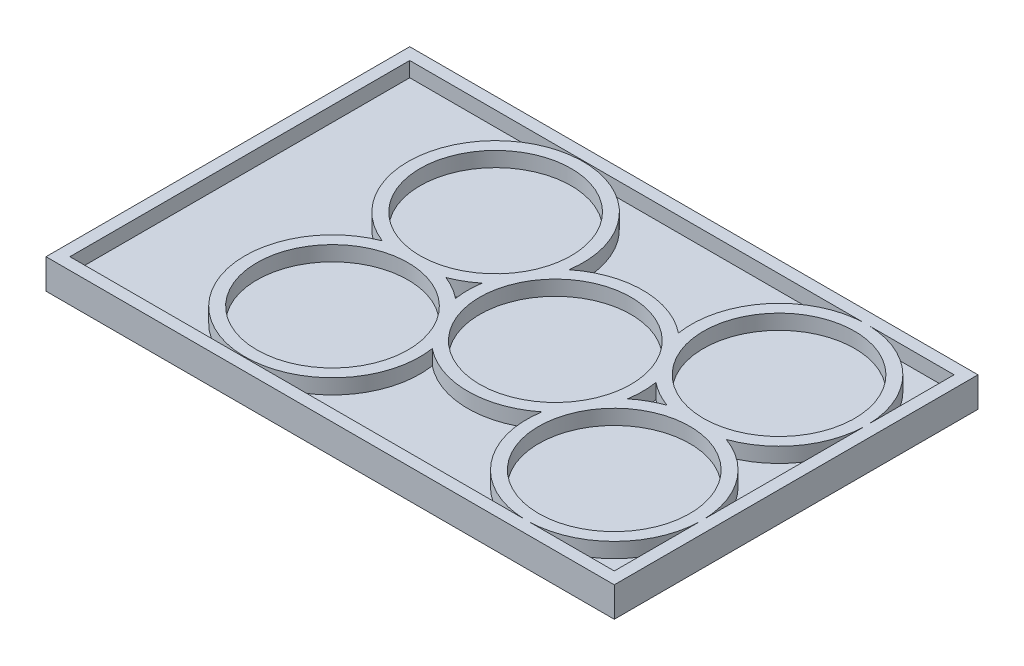
from build123d import *

# Parameters (mm, degrees)
SKETCH1_W           = 76.04
SKETCH1_H           = 48.67
BOSS_EXTRUDE1_DEPTH = 2
SKETCH2_R           = 10.115
BOSS_EXTRUDE5_DEPTH = 2
BOSS_EXTRUDE6_DEPTH = 2


with BuildPart() as part:
    # Sketch1 → Boss-Extrude1 (new body)
    with BuildSketch(Plane(origin=(0, 0, 0), x_dir=(1, 0, 0), z_dir=(0, 1, 0))):
        with Locations((-5.18381875, 15.397172461)):
            Rectangle(SKETCH1_W, SKETCH1_H)
    extrude(amount=BOSS_EXTRUDE1_DEPTH)

    # Sketch2 → Boss-Extrude5 (add)
    with BuildSketch(Plane(origin=(0, 2, 0), x_dir=(1, 0, 0), z_dir=(0, 1, 0))):
        with BuildLine():
            ThreePointArc((7.966863666, 24.51864889), (0.632329313, 27.112160631), (-6.709546926, 24.539506243))
            ThreePointArc((-6.709546926, 24.539506243), (-24.147153985, 36.457660066), (-22.544533536, 15.397172461))
            ThreePointArc((-22.544533536, 15.397172461), (-24.147153985, -5.663315144), (-6.709546926, 6.254838679))
            ThreePointArc((-6.709546926, 6.254838679), (0.632329313, 3.682184291), (7.966863666, 6.275696032))
            ThreePointArc((7.966863666, 6.275696032), (10.484956429, -3.077490534), (19.183945951, -7.337827539))
            Line((19.183945951, -7.337827539), (19.868416549, -7.337827539))
            ThreePointArc((19.868416549, -7.337827539), (27.809937192, -3.911583481), (31.23618125, 4.029937162))
            Line((31.23618125, 4.029937162), (31.23618125, 4.71440776))
            ThreePointArc((31.23618125, 4.71440776), (29.009139273, 11.250742962), (23.487317451, 15.397172461))
            ThreePointArc((23.487317451, 15.397172461), (29.009139273, 19.54360196), (31.23618125, 26.079937162))
            Line((31.23618125, 26.079937162), (31.23618125, 26.76440776))
            ThreePointArc((31.23618125, 26.76440776), (27.809937192, 34.705928403), (19.868416549, 38.132172461))
            Line((19.868416549, 38.132172461), (19.183945951, 38.132172461))
            ThreePointArc((19.183945951, 38.132172461), (10.484956429, 33.871835456), (7.966863666, 24.51864889))
        make_face()
        with Locations(Location((-18.289653985, 4.482172461, 0), (0, 0, 270))):
            Circle(SKETCH2_R, mode=Mode.SUBTRACT)
        with Locations(Location((0.61568058, 15.397172461, 0), (0, 0, 270))):
            Circle(SKETCH2_R, mode=Mode.SUBTRACT)
        with Locations(Location((19.52618125, 4.372172461, 0), (0, 0, 270))):
            Circle(SKETCH2_R, mode=Mode.SUBTRACT)
        with Locations(Location((-18.289653985, 26.312172461, 0), (0, 0, 270))):
            Circle(SKETCH2_R, mode=Mode.SUBTRACT)
        with BuildLine():
            ThreePointArc((-10.964426478, 17.169838679), (-11.09931942, 15.397172461), (-10.964426478, 13.624506243))
            ThreePointArc((-10.964426478, 13.624506243), (-12.432153985, 14.627660066), (-14.034774433, 15.397172461))
            ThreePointArc((-14.034774433, 15.397172461), (-12.432153985, 16.166684856), (-10.964426478, 17.169838679))
        make_face(mode=Mode.SUBTRACT)
        with BuildLine():
            ThreePointArc((12.174998164, 13.49364889), (12.33068058, 15.397172461), (12.174998164, 17.300696032))
            ThreePointArc((12.174998164, 17.300696032), (13.790504097, 16.207318933), (15.565045049, 15.397172461))
            ThreePointArc((15.565045049, 15.397172461), (13.790504097, 14.587025989), (12.174998164, 13.49364889))
        make_face(mode=Mode.SUBTRACT)
        with Locations(Location((19.52618125, 26.422172461, 0), (0, 0, 270))):
            Circle(SKETCH2_R, mode=Mode.SUBTRACT)
    extrude(amount=BOSS_EXTRUDE5_DEPTH)

    # Sketch3 → Boss-Extrude6 (add)
    with BuildSketch(Plane(origin=(0, 2, 0), x_dir=(1, 0, 0), z_dir=(0, 1, 0))):
        Polygon((-41.60381875, 39.732172461), (-43.20381875, 39.732172461), (-43.20381875, -8.937827539), (31.23618125, -8.937827539), (32.83618125, -8.937827539), (32.83618125, 39.732172461), align=None)
        Polygon((-41.60381875, -7.337827539), (-41.60381875, 38.132172461), (19.183945951, 38.132172461), (19.868416549, 38.132172461), (31.23618125, 38.132172461), (31.23618125, 26.76440776), (31.23618125, 26.079937162), (31.23618125, 4.71440776), (31.23618125, 4.029937162), (31.23618125, -7.337827539), (19.868416549, -7.337827539), (19.183945951, -7.337827539), align=None, mode=Mode.SUBTRACT)
    extrude(amount=BOSS_EXTRUDE6_DEPTH)


solid = part.part
